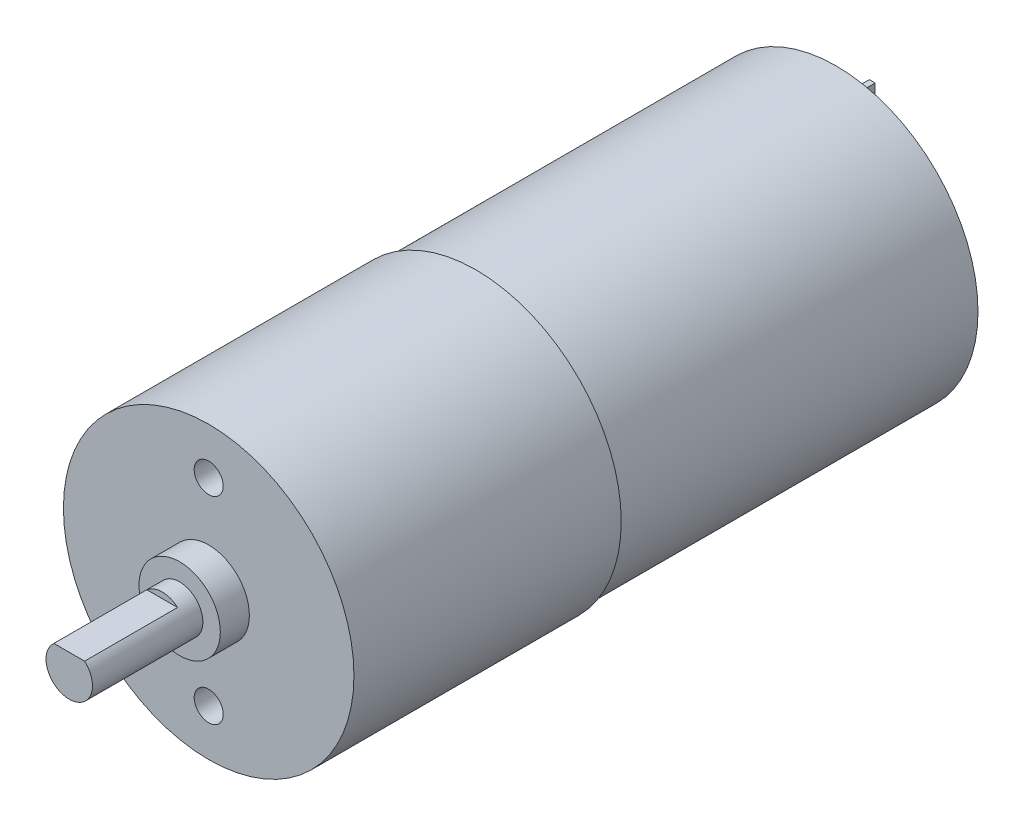
from build123d import *

# Parameters (mm, degrees)
SKETCH1_R             = 12.5
BOSS_EXTRUDE1_DEPTH   = 23
SKETCH2_R             = 3.5
BOSS_EXTRUDE2_DEPTH   = 2.5
SKETCH3_R             = 2
BOSS_EXTRUDE4_DEPTH   = 9.5
SKETCH4_W             = 2.645751312
SKETCH4_H             = 0.5
CUT_EXTRUDE1_DEPTH    = 8
SKETCH5_R             = 12.2
BOSS_EXTRUDE5_DEPTH   = 31
SKETCH6_R             = 3.2
BOSS_EXTRUDE6_DEPTH   = 1.4
SKETCH7_W             = 0.5
SKETCH7_H             = 2
BOSS_EXTRUDE7_DEPTH   = 3.1
M3_TAPPED_HOLE1_D     = 2.5
M3_TAPPED_HOLE1_DEPTH = 8.5
M3_TAPPED_HOLE1_TIP   = 0.751075774


with BuildPart() as part:
    # Sketch1 → Boss-Extrude1 (new body)
    with BuildSketch(Plane.XY):
        Circle(SKETCH1_R)
    extrude(amount=-BOSS_EXTRUDE1_DEPTH)

    # Sketch2 → Boss-Extrude2 (add)
    with BuildSketch(Plane.XY):
        Circle(SKETCH2_R)
    extrude(amount=BOSS_EXTRUDE2_DEPTH)

    # Sketch3 → Boss-Extrude4 (add)
    with BuildSketch(Plane.XY.offset(2.5)):
        Circle(SKETCH3_R)
    extrude(amount=BOSS_EXTRUDE4_DEPTH)

    # Sketch4 → Cut-Extrude1 (cut)
    with BuildSketch(Plane.XY.offset(12)):
        with Locations((0, 1.75)):
            Rectangle(SKETCH4_W, SKETCH4_H)
    extrude(amount=-CUT_EXTRUDE1_DEPTH, mode=Mode.SUBTRACT)

    # Sketch5 → Boss-Extrude5 (add)
    with BuildSketch(Plane(origin=(0, 0, -23), x_dir=(-1, 0, 0), z_dir=(0, 0, -1))):
        with Locations(Location((0, 0, 0), (0, 0, 180))):
            Circle(SKETCH5_R)
    extrude(amount=BOSS_EXTRUDE5_DEPTH)

    # Sketch6 → Boss-Extrude6 (add)
    with BuildSketch(Plane(origin=(0, 0, -54), x_dir=(-1, 0, 0), z_dir=(0, 0, -1))):
        Circle(SKETCH6_R)
    extrude(amount=BOSS_EXTRUDE6_DEPTH)

    # Sketch7 → Boss-Extrude7 (add)
    with BuildSketch(Plane(origin=(0, 0, -54), x_dir=(-1, 0, 0), z_dir=(0, 0, -1))):
        with Locations((0, 8.5)):
            Rectangle(SKETCH7_W, SKETCH7_H)
        with Locations((0, -8.5)):
            Rectangle(SKETCH7_W, SKETCH7_H)
    extrude(amount=BOSS_EXTRUDE7_DEPTH)

    # M3 Tapped Hole1
    with Locations(Plane.XY):
        with Locations((0, 8.5), (0, -8.5)):
            Hole(M3_TAPPED_HOLE1_D / 2, depth=M3_TAPPED_HOLE1_DEPTH)
            with Locations((0, 0, -(M3_TAPPED_HOLE1_DEPTH + M3_TAPPED_HOLE1_TIP / 2))):  # 118° drill point
                Cone(0, M3_TAPPED_HOLE1_D / 2, M3_TAPPED_HOLE1_TIP, mode=Mode.SUBTRACT)


solid = part.part
